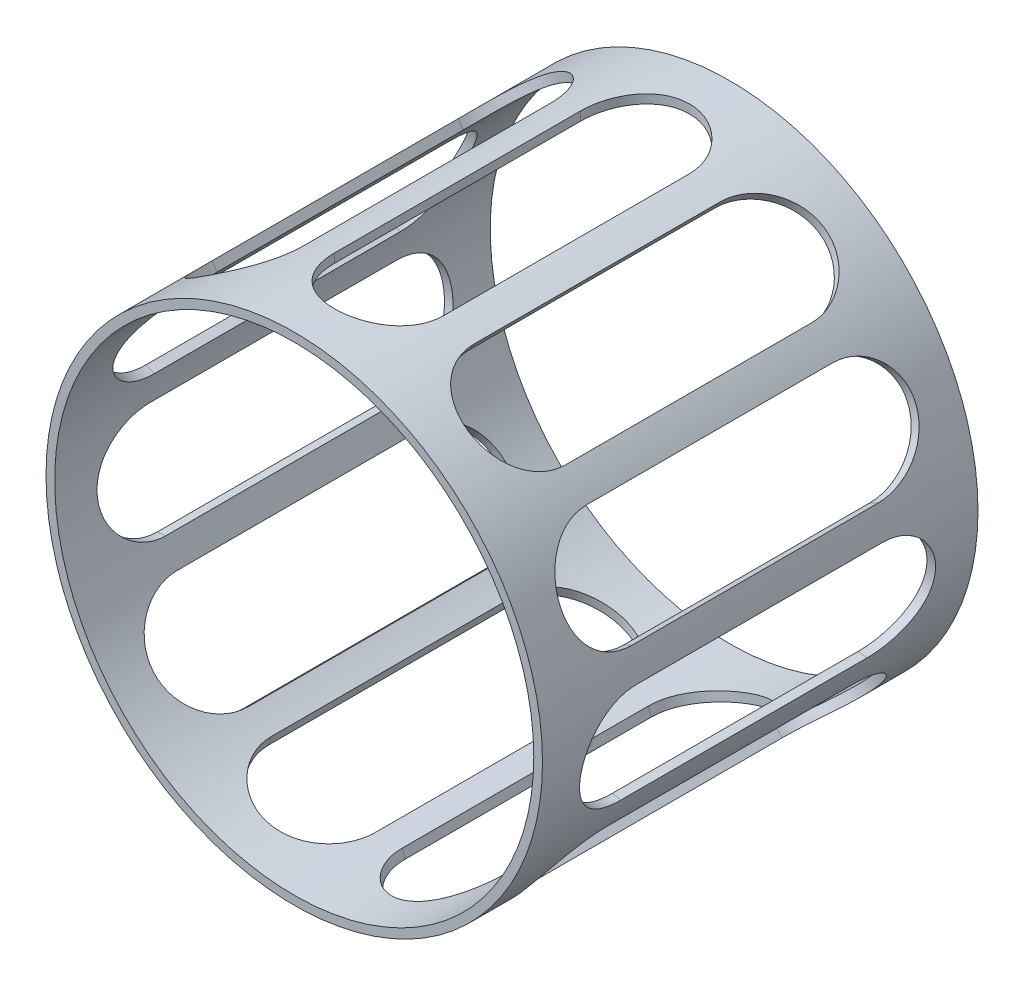
from build123d import *

# Parameters (mm, degrees)
SKETCH1_R               = 114
SKETCH1_R_2             = 110
EXTRUDE_THIN1_DEPTH     = 200
CUT_EXTRUDE1_REACH      = 259.943
CUT_EXTRUDE1_END_RADIUS = 114
SKETCH3_R               = 25
SKETCH3_W               = 50
SKETCH3_H               = 113
CIRPATTERN1_COUNT       = 11


with BuildPart() as part:
    # Sketch1 → Extrude-Thin1 (new body)
    with BuildSketch(Plane.XY):
        with Locations((0, 2.354418005)):
            Circle(SKETCH1_R)
        with Locations((0, 2.354418005)):
            Circle(SKETCH1_R_2, mode=Mode.SUBTRACT)
    extrude(amount=EXTRUDE_THIN1_DEPTH)

    # Cut-Extrude1: up to this cylinder (the profile starts inside it)
    cut_extrude1_end = Plane(origin=(0, 2.354418005, 100), z_dir=(0, 0, -1)) * Cylinder(CUT_EXTRUDE1_END_RADIUS, 861.886, mode=Mode.PRIVATE)
    # Sketch3 → Cut-Extrude1 (cut, up to the surface)
    with BuildSketch(Plane(origin=(0, 0, 0), x_dir=(1, 0, 0), z_dir=(0, 1, 0)), mode=Mode.PRIVATE) as cut_extrude1_sk1:
        with Locations((0, -43.5)):
            Circle(SKETCH3_R)
    cut_extrude1_tool1 = extrude(cut_extrude1_sk1.sketch, amount=CUT_EXTRUDE1_REACH, mode=Mode.PRIVATE) & cut_extrude1_end
    # Sketch3 → Cut-Extrude1 (cut, up to the surface)
    with BuildSketch(Plane(origin=(0, 0, 0), x_dir=(1, 0, 0), z_dir=(0, 1, 0)), mode=Mode.PRIVATE) as cut_extrude1_sk2:
        with Locations((0, -156.5)):
            Circle(SKETCH3_R)
    cut_extrude1_tool2 = extrude(cut_extrude1_sk2.sketch, amount=CUT_EXTRUDE1_REACH, mode=Mode.PRIVATE) & cut_extrude1_end
    # Sketch3 → Cut-Extrude1 (cut, up to the surface)
    with BuildSketch(Plane(origin=(0, 0, 0), x_dir=(1, 0, 0), z_dir=(0, 1, 0)), mode=Mode.PRIVATE) as cut_extrude1_sk3:
        with Locations((0, -100)):
            Rectangle(SKETCH3_W, SKETCH3_H)
    cut_extrude1_tool3 = extrude(cut_extrude1_sk3.sketch, amount=CUT_EXTRUDE1_REACH, mode=Mode.PRIVATE) & cut_extrude1_end
    cut_extrude1 = cut_extrude1_tool1.solids().sort_by_distance((0, 0, 43.5))[0] + cut_extrude1_tool2.solids().sort_by_distance((0, 0, 156.5))[0] + cut_extrude1_tool3.solids().sort_by_distance((0, 0, 100))[0]
    add(cut_extrude1, mode=Mode.SUBTRACT)

    # CirPattern1: Cut-Extrude1 ×11 about axis
    cirpattern1_axis = Axis((0, 2.354418005, 0), (0, 0, 1))
    for i in range(1, CIRPATTERN1_COUNT):
        add(cut_extrude1.rotate(cirpattern1_axis, i * 360 / CIRPATTERN1_COUNT), mode=Mode.SUBTRACT)


solid = part.part
